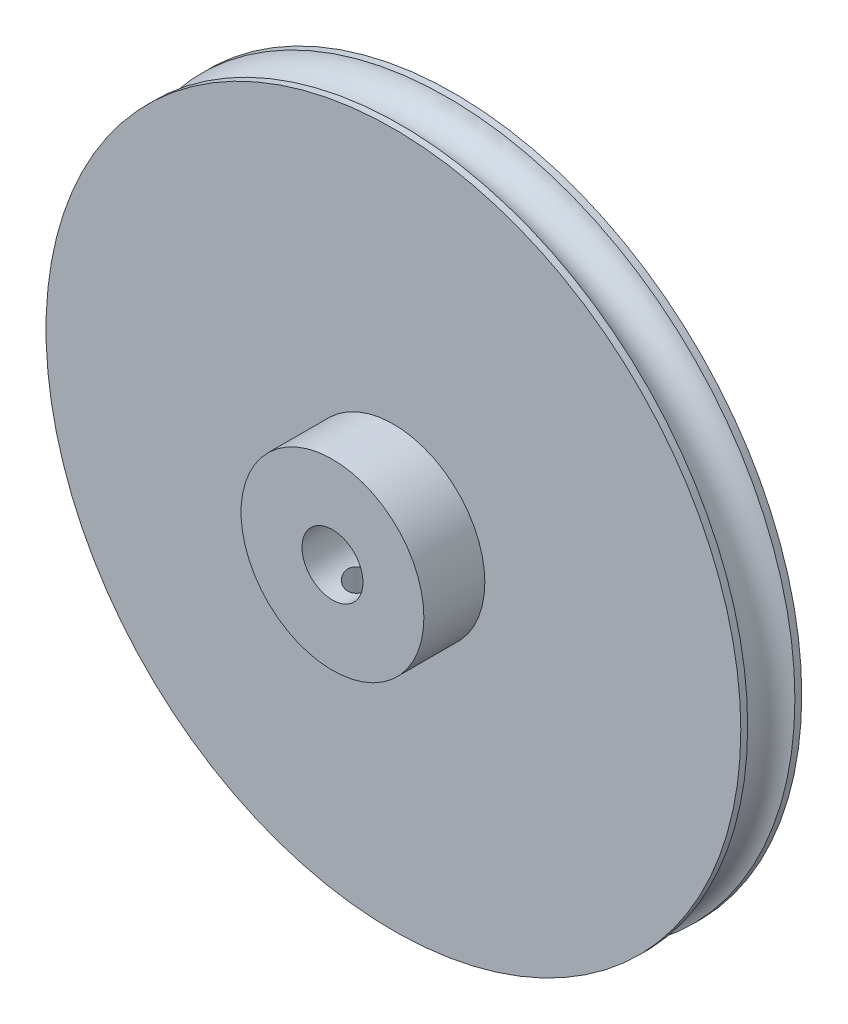
from build123d import *

# Parameters (mm, degrees)
ESQUISSE1_R      = 28.5
EXTRUSION1_DEPTH = 5
ESQUISSE2_R      = 7.5
EXTRUSION2_DEPTH = 5
EXTRUSION3_REACH = 43.527
ESQUISSE3_R      = 2.5
ESQUISSE12_W     = 1.25
ESQUISSE12_H     = 28.5


with BuildPart() as part:
    # Esquisse1 → Extrusion1 (new body)
    with BuildSketch(Plane.XY):
        Circle(ESQUISSE1_R)
    extrude(amount=-EXTRUSION1_DEPTH)

    # Esquisse2 → Extrusion2 (add)
    with BuildSketch(Plane.XY):
        Circle(ESQUISSE2_R)
    extrude(amount=EXTRUSION2_DEPTH)

    # Esquisse3 → Extrusion3 (cut, up to next)
    with BuildSketch(Plane.XY.offset(5), mode=Mode.PRIVATE) as extrusion3_sk1:
        Circle(ESQUISSE3_R)
    extrusion3_tool1 = extrude(extrusion3_sk1.sketch, amount=-EXTRUSION3_REACH, mode=Mode.PRIVATE) & part.part
    add(extrusion3_tool1.solids().sort_by_distance((0, 0, 5))[0], mode=Mode.SUBTRACT)

    # Esquisse6 → Enlèvement de matière-Révolution3 (revolve, cut)
    with BuildSketch(Plane(origin=(0, 0, 0), x_dir=(1, 0, 0), z_dir=(0, 1, 0)), mode=Mode.PRIVATE) as enl_vement_de_mati_re_r_volution3_sk:
        with BuildLine():
            Line((-29, 4.5), (-31.449617094, 4.5))
            Line((-31.449617094, 4.5), (-31.449617094, 0.5))
            Line((-31.449617094, 0.5), (-29, 0.5))
            ThreePointArc((-29, 0.5), (-27, 2.5), (-29, 4.5))
        make_face()
    revolve(enl_vement_de_mati_re_r_volution3_sk.sketch.rotate(Axis((0, 0, 5), (0, 0, -1)), 180), axis=Axis((0, 0, 5), (0, 0, -1)), mode=Mode.SUBTRACT)

    # Esquisse12 → Trou taraudé M3x0.55 (revolve, cut)
    with BuildSketch(Plane(origin=(0, 0, 2.5), x_dir=(0, 0, 1), z_dir=(1, 0, 0))):
        with Locations((0.625, 14.25)):
            Rectangle(ESQUISSE12_W, ESQUISSE12_H)
    revolve(axis=Axis((0, 6.35, 2.5), (0, -1, 0)), mode=Mode.SUBTRACT)


solid = part.part
